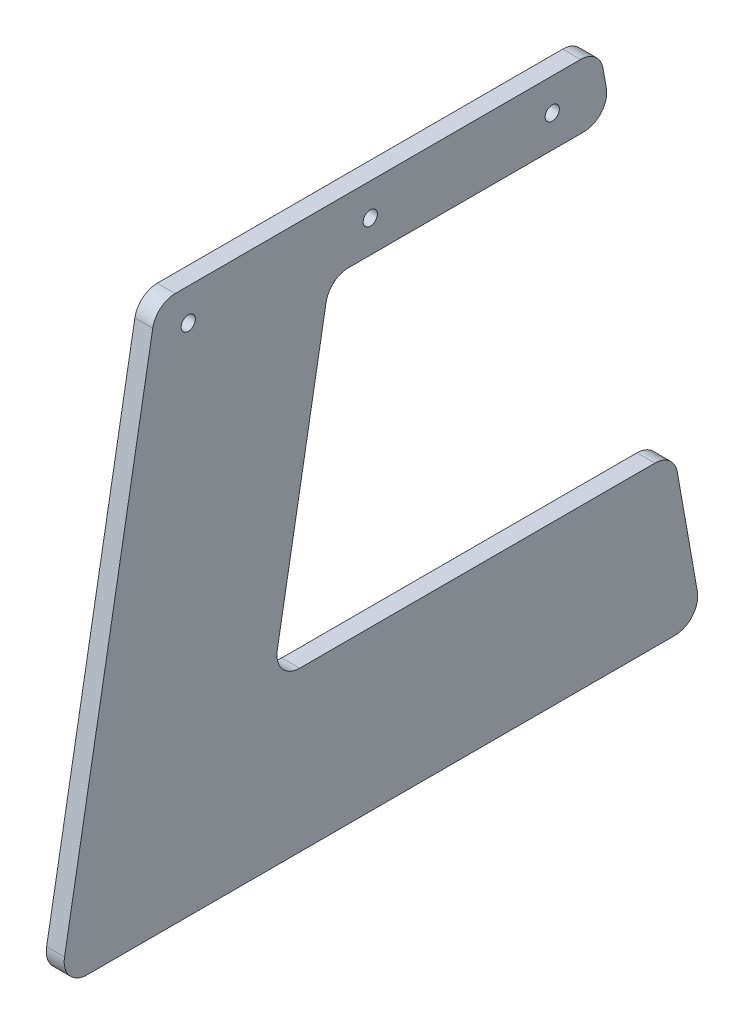
from build123d import *

# Parameters (mm, degrees)
SKETCH1_R           = 3.96875
BOSS_EXTRUDE1_DEPTH = 10


with BuildPart() as part:
    # Sketch1 → Boss-Extrude1 (new body)
    with BuildSketch(Plane(origin=(0, 0, 0), x_dir=(0, 0, -1), z_dir=(1, 0, 0))):
        with BuildLine():
            Line((98.955633629, 131.384307372), (97.100493147, 141.905331856))
            ThreePointArc((97.100493147, 141.905331856), (92.756837327, 149.428764428), (84.593434684, 152.4))
            Line((84.593434684, 152.4), (-141.743434684, 152.4))
            ThreePointArc((-141.743434684, 152.4), (-149.906837327, 149.428764428), (-154.250493147, 141.905331856))
            Line((-154.250493147, 141.905331856), (-203.516251557, -137.494668144))
            ThreePointArc((-203.516251557, -137.494668144), (-200.737957522, -147.863402643), (-191.009193094, -152.4))
            Line((-191.009193094, -152.4), (137.264729374, -152.4))
            ThreePointArc((137.264729374, -152.4), (146.993493802, -147.863402643), (149.771787837, -137.494668144))
            Line((149.771787837, -137.494668144), (138.575024562, -73.994668144))
            ThreePointArc((138.575024562, -73.994668144), (134.231368742, -66.471235572), (126.067966099, -63.5))
            Line((126.067966099, -63.5), (-72.261492649, -63.5))
            ThreePointArc((-72.261492649, -63.5), (-81.990257077, -58.963402643), (-84.768551112, -48.594668144))
            Line((-84.768551112, -48.594668144), (-57.512107079, 105.984307372))
            ThreePointArc((-57.512107079, 105.984307372), (-53.168451258, 113.507739943), (-45.005048615, 116.478975516))
            Line((-45.005048615, 116.478975516), (86.448575165, 116.478975516))
            ThreePointArc((86.448575165, 116.478975516), (96.177339593, 121.015572873), (98.955633629, 131.384307372))
        make_face()
        with Locations((-134.439487758, 134.439487758)):
            Circle(SKETCH1_R, mode=Mode.SUBTRACT)
        with Locations((-32.839487758, 134.439487758)):
            Circle(SKETCH1_R, mode=Mode.SUBTRACT)
        with Locations((68.760512242, 134.439487758)):
            Circle(SKETCH1_R, mode=Mode.SUBTRACT)
    extrude(amount=BOSS_EXTRUDE1_DEPTH)


solid = part.part
